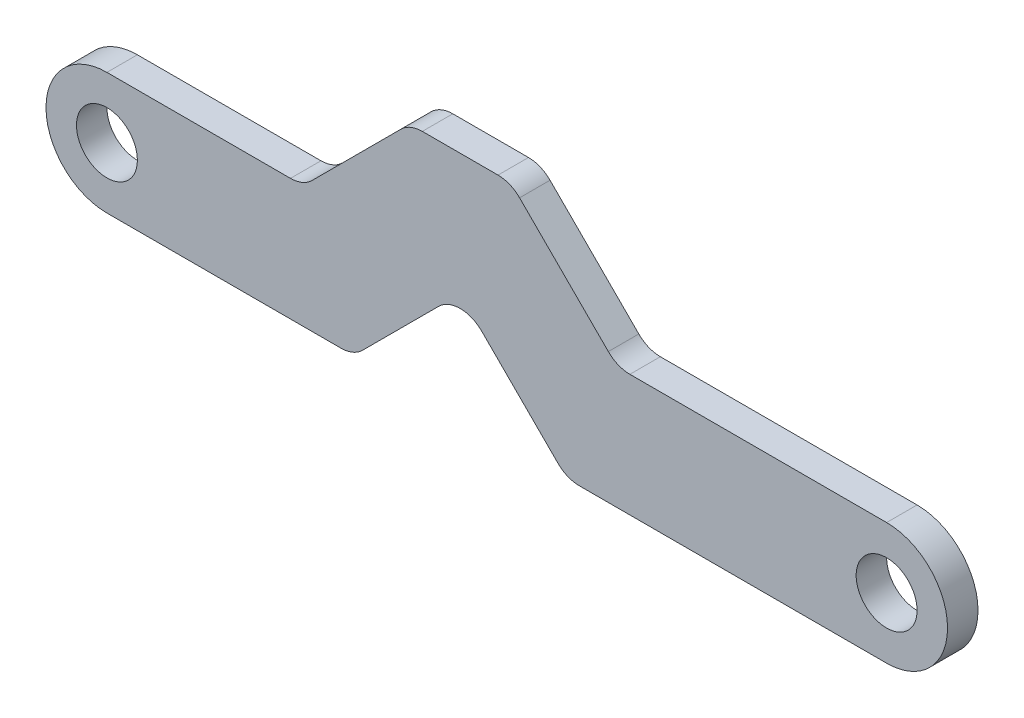
from build123d import *

# Parameters (mm, degrees)
SKETCH_1_R      = 1
EXTRUDE_1_DEPTH = 0.5
EXTRUDE1_DEPTH  = 0.5
EXTRUDE2_DEPTH  = 0.5
FILLET8_R       = 1
FILLET9_R       = 1


with BuildPart() as part:
    # Эскиз1 → Бобышка-Вытянуть1 (new, symmetric)
    with BuildSketch(Plane.XY):
        with BuildLine():
            Line((0, 2), (-25.5979, 2))
            ThreePointArc((-25.5979, 2), (-27.5979, 0), (-25.5979, -2))
            Line((-25.5979, -2), (0, -2))
            ThreePointArc((0, -2), (2, 0), (0, 2))
        make_face()
        with Locations((-25.5979, 0)):
            Circle(SKETCH_1_R, mode=Mode.SUBTRACT)
        Circle(SKETCH_1_R, mode=Mode.SUBTRACT)
    extrude(amount=EXTRUDE_1_DEPTH, both=True)

    # Sketch1 → Extrude1 (add, symmetric)
    with BuildSketch(Plane.XY):
        Polygon((-8.843145751, 2), (-12.343145751, 5.5), (-15.656854249, 5.5), (-19.156854249, 2), align=None)
    extrude(amount=EXTRUDE1_DEPTH, both=True)

    # Sketch → Extrude2 (cut, symmetric)
    with BuildSketch(Plane.XY):
        Polygon((-10.5, -2), (-14, 1.5), (-17.5, -2), align=None)
    extrude(amount=EXTRUDE2_DEPTH, both=True, mode=Mode.SUBTRACT)

    # Fillet8
    fillet8_edges = [part.edges().sort_by_distance(p)[0] for p in [
        (-8.843145751, 2, 0),
        (-19.156854249, 2, 0),
        (-14, 1.5, 0),
    ]]
    fillet(fillet8_edges, radius=FILLET8_R)

    # Fillet9
    fillet9_edges = [part.edges().sort_by_distance(p)[0] for p in [
        (-15.656854249, 5.5, 0),
        (-12.343145751, 5.5, 0),
        (-17.5, -2, 0),
        (-10.5, -2, 0),
    ]]
    fillet(fillet9_edges, radius=FILLET9_R)


solid = part.part
